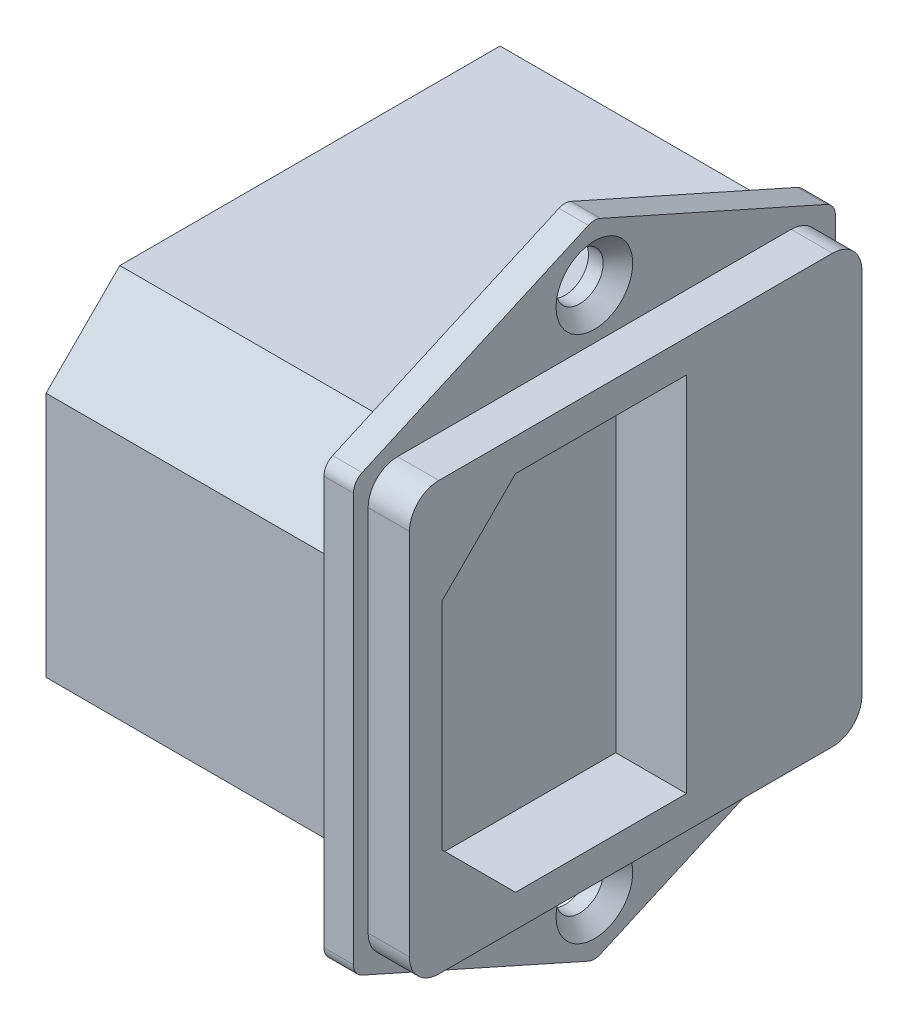
from build123d import *

# Parameters (mm, degrees)
SKETCH1_R           = 1.6
SKETCH1_W           = 29
SKETCH1_H           = 32.7
BOSS_EXTRUDE1_DEPTH = 2
SKETCH2_W           = 29
SKETCH2_H           = 30.7
BOSS_EXTRUDE2_DEPTH = 2.8
SKETCH3_W           = 24.6
SKETCH3_H           = 16.6
CUT_EXTRUDE1_DEPTH  = 28.669522945
CHAMFER1_SIZE       = 1
CHAMFER2_SIZE       = 5
BOSS_EXTRUDE3_DEPTH = 19.8
FILLET1_R           = 1
FILLET2_R           = 2


with BuildPart() as part:
    # Sketch1 → Boss-Extrude1 (new body)
    # profile 1 of 3: a face of its own
    with BuildSketch(Plane.YZ):
        Polygon((14.5, -16.35), (21.8, 0), (14.5, 16.35), align=None)
        with Locations(Location((17.9, 0, 0), (0, 0, 270))):
            Circle(SKETCH1_R, mode=Mode.SUBTRACT)
    # profile 2 of 3: a face of its own
    with BuildSketch(Plane.YZ):
        Rectangle(SKETCH1_W, SKETCH1_H)
    # profile 3 of 3: a face of its own
    with BuildSketch(Plane.YZ):
        Polygon((-14.5, 16.35), (-21.8, 0), (-14.5, -16.35), align=None)
        with Locations(Location((-17.9, 0, 0), (0, 0, 270))):
            Circle(SKETCH1_R, mode=Mode.SUBTRACT)
    extrude(amount=BOSS_EXTRUDE1_DEPTH)

    # Sketch2 → Boss-Extrude2 (add)
    with BuildSketch(Plane.YZ.offset(2)):
        Rectangle(SKETCH2_W, SKETCH2_H)
    extrude(amount=BOSS_EXTRUDE2_DEPTH)

    # Sketch3 → Cut-Extrude1 (cut, through all)
    with BuildSketch(Plane.YZ.offset(4.8)):
        with Locations((0, 4.85)):
            Rectangle(SKETCH3_W, SKETCH3_H)
    extrude(amount=-CUT_EXTRUDE1_DEPTH, mode=Mode.SUBTRACT)

    # Chamfer1
    chamfer1_edges = [part.edges().sort_by_distance(p)[0] for p in [
        (2, -17.9, 1.6),
        (2, 17.9, 1.6),
    ]]
    chamfer(chamfer1_edges, length=CHAMFER1_SIZE)

    # Chamfer2
    chamfer2_edges = [part.edges().sort_by_distance(p)[0] for p in [
        (2.4, 12.3, 13.15),
        (2.4, -12.3, 13.15),
    ]]
    chamfer(chamfer2_edges, length=CHAMFER2_SIZE)

    # Sketch4 → Boss-Extrude3 (add)
    with BuildSketch(Plane(origin=(0, 0, 0), x_dir=(0, -1, 0), z_dir=(-1, 0, 0))):
        Polygon((-13.35, 10.4), (-13.35, -15.4), (13.35, -15.4), (13.35, 10.4), (8.35, 15.4), (-8.35, 15.4), align=None)
    extrude(amount=BOSS_EXTRUDE3_DEPTH)

    # Fillet1
    fillet1_edges = [part.edges().sort_by_distance(p)[0] for p in [
        (1, 14.5, -16.35),
        (1, -14.5, -16.35),
        (1, -21.8, 0),
        (1, -14.5, 16.35),
        (1, 14.5, 16.35),
        (1, 21.8, 0),
    ]]
    fillet(fillet1_edges, radius=FILLET1_R)

    # Fillet2
    fillet2_edges = [part.edges().sort_by_distance(p)[0] for p in [
        (3.4, -14.5, 15.35),
        (3.4, -14.5, -15.35),
        (3.4, 14.5, -15.35),
        (3.4, 14.5, 15.35),
    ]]
    fillet(fillet2_edges, radius=FILLET2_R)


solid = part.part
